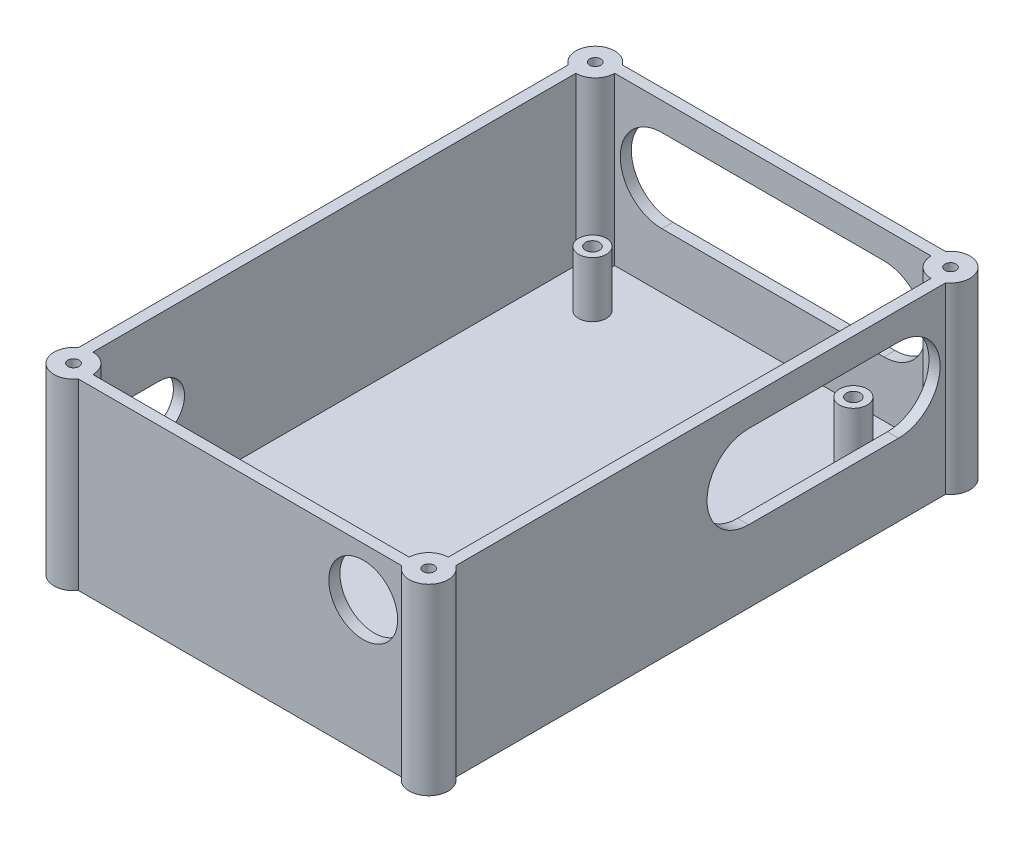
from build123d import *

# Parameters (mm, degrees)
SKETCH1_R             = 2.5
SKETCH1_R_2           = 1.25
BOSS_EXTRUDE1_DEPTH   = 10
BOSS_EXTRUDE1_2_DEPTH = 10
BOSS_EXTRUDE1_3_DEPTH = 10
BOSS_EXTRUDE1_4_DEPTH = 10
SKETCH2_W             = 68
SKETCH2_H             = 98
BOSS_EXTRUDE2_DEPTH   = 3
SKETCH3_W             = 68
SKETCH3_H             = 98
SKETCH3_W_2           = 64
SKETCH3_H_2           = 94
BOSS_EXTRUDE3_DEPTH   = 30
SKETCH4_R             = 6.2
CUT_EXTRUDE1_DEPTH    = 25
CUT_EXTRUDE2_DEPTH    = 5
SKETCH7_R             = 3.5
BOSS_EXTRUDE5_DEPTH   = 33
SKETCH8_R             = 1
CUT_EXTRUDE3_DEPTH    = 7
CUT_EXTRUDE6_DEPTH    = 3.3
CUT_EXTRUDE7_DEPTH    = 10


with BuildPart() as part:
    # Sketch1 → Boss-Extrude1 (new body)
    with BuildSketch(Plane(origin=(0, 0, 0), x_dir=(1, 0, 0), z_dir=(0, 1, 0))):
        with Locations(Location((24.328009845, -38, 0), (0, 0, 270))):
            Circle(SKETCH1_R)
        with Locations(Location((24.328009845, -38, 0), (0, 0, 270))):
            Circle(SKETCH1_R_2, mode=Mode.SUBTRACT)
    extrude(amount=BOSS_EXTRUDE1_DEPTH)



with BuildPart() as body_2:
    # Sketch1 → Boss-Extrude1 2 (new body)
    with BuildSketch(Plane(origin=(0, 0, 0), x_dir=(1, 0, 0), z_dir=(0, 1, 0))):
        with Locations(Location((24.328009845, 38, 0), (0, 0, 270))):
            Circle(SKETCH1_R)
        with Locations(Location((24.328009845, 38, 0), (0, 0, 270))):
            Circle(SKETCH1_R_2, mode=Mode.SUBTRACT)
    extrude(amount=BOSS_EXTRUDE1_2_DEPTH)


with BuildPart() as body_3:
    # Sketch1 → Boss-Extrude1 3 (new body)
    with BuildSketch(Plane(origin=(0, 0, 0), x_dir=(1, 0, 0), z_dir=(0, 1, 0))):
        with Locations(Location((-22.671990155, 38, 0), (0, 0, 270))):
            Circle(SKETCH1_R)
        with Locations(Location((-22.671990155, 38, 0), (0, 0, 270))):
            Circle(SKETCH1_R_2, mode=Mode.SUBTRACT)
    extrude(amount=BOSS_EXTRUDE1_3_DEPTH)


with BuildPart() as body_4:
    # Sketch1 → Boss-Extrude1 4 (new body)
    with BuildSketch(Plane(origin=(0, 0, 0), x_dir=(1, 0, 0), z_dir=(0, 1, 0))):
        with Locations(Location((-22.671990155, -38, 0), (0, 0, 270))):
            Circle(SKETCH1_R)
        with Locations(Location((-22.671990155, -38, 0), (0, 0, 270))):
            Circle(SKETCH1_R_2, mode=Mode.SUBTRACT)
    extrude(amount=BOSS_EXTRUDE1_4_DEPTH)


with BuildPart() as part_1:
    add(part.part)

    add(body_2.part)  # Boss-Extrude2 merges body 2

    add(body_3.part)  # Boss-Extrude2 merges body 3

    add(body_4.part)  # Boss-Extrude2 merges body 4
    # Sketch2 → Boss-Extrude2 (add)
    with BuildSketch(Plane(origin=(0, 0, 0), x_dir=(1, 0, 0), z_dir=(0, 1, 0))):
        with Locations((0.828009845, 0)):
            Rectangle(SKETCH2_W, SKETCH2_H)
    extrude(amount=-BOSS_EXTRUDE2_DEPTH)

    # Sketch3 → Boss-Extrude3 (add)
    with BuildSketch(Plane(origin=(0, 0, 0), x_dir=(1, 0, 0), z_dir=(0, 1, 0))):
        with Locations((0.828009845, 0)):
            Rectangle(SKETCH3_W, SKETCH3_H)
        with Locations((0.828009845, 0)):
            Rectangle(SKETCH3_W_2, SKETCH3_H_2, mode=Mode.SUBTRACT)
    extrude(amount=BOSS_EXTRUDE3_DEPTH)

    # Sketch4 → Cut-Extrude1 (cut)
    with BuildSketch(Plane.XY.offset(49)):
        with Locations((23.028009845, 21.2)):
            Circle(SKETCH4_R)
    extrude(amount=-CUT_EXTRUDE1_DEPTH, mode=Mode.SUBTRACT)

    # Sketch5 → Cut-Extrude2 (cut)
    with BuildSketch(Plane.ZY.offset(33.171990155)):
        with BuildLine():
            Line((42.5, 19.5), (31.5, 19.5))
            ThreePointArc((31.5, 19.5), (28.318019485, 18.181980515), (27, 15))
            Line((27, 15), (37, 15))
            Line((37, 15), (47, 15))
            ThreePointArc((47, 15), (45.681980515, 18.181980515), (42.5, 19.5))
        make_face()
        with BuildLine():
            Line((37, 15), (27, 15))
            ThreePointArc((27, 15), (28.318019485, 11.818019485), (31.5, 10.5))
            Line((31.5, 10.5), (37, 10.5))
            Line((37, 10.5), (37, 15))
        make_face()
        with BuildLine():
            ThreePointArc((42.5, 10.5), (45.681980515, 11.818019485), (47, 15))
            Line((47, 15), (37, 15))
            Line((37, 15), (37, 10.5))
            Line((37, 10.5), (42.5, 10.5))
        make_face()
    extrude(amount=-CUT_EXTRUDE2_DEPTH, mode=Mode.SUBTRACT)

    # Sketch7 → Boss-Extrude5 (add)
    with BuildSketch(Plane(origin=(0, 30, 0), x_dir=(1, 0, 0), z_dir=(0, 1, 0))):
        with Locations((32.828009845, -47)):
            Circle(SKETCH7_R)
        with Locations((32.828009845, 47)):
            Circle(SKETCH7_R)
        with Locations((-31.171990155, 47)):
            Circle(SKETCH7_R)
        with Locations((-31.171990155, -47)):
            Circle(SKETCH7_R)
    extrude(amount=-BOSS_EXTRUDE5_DEPTH)

    # Sketch8 → Cut-Extrude3 (cut)
    with BuildSketch(Plane(origin=(0, 30, 0), x_dir=(1, 0, 0), z_dir=(0, 1, 0))):
        with Locations(Location((-31.171990155, -47, 0), (0, 0, 270))):
            Circle(SKETCH8_R)
        with Locations(Location((32.828009845, -47, 0), (0, 0, 270))):
            Circle(SKETCH8_R)
        with Locations(Location((32.828009845, 47, 0), (0, 0, 270))):
            Circle(SKETCH8_R)
        with Locations(Location((-31.171990155, 47, 0), (0, 0, 270))):
            Circle(SKETCH8_R)
    extrude(amount=-CUT_EXTRUDE3_DEPTH, mode=Mode.SUBTRACT)

    # Sketch12 → Cut-Extrude6 (cut)
    with BuildSketch(Plane(origin=(0, 0, -49), x_dir=(-1, 0, 0), z_dir=(0, 0, -1))):
        with BuildLine():
            Line((-20.828009845, 25), (19.171990155, 25))
            ThreePointArc((19.171990155, 25), (26.671990155, 17.5), (19.171990155, 10))
            Line((19.171990155, 10), (-20.828009845, 10))
            ThreePointArc((-20.828009845, 10), (-28.328009845, 17.5), (-20.828009845, 25))
        make_face()
    extrude(amount=-CUT_EXTRUDE6_DEPTH, mode=Mode.SUBTRACT)

    # Sketch14 → Cut-Extrude7 (cut)
    with BuildSketch(Plane(origin=(34.828009845, 0, 0), x_dir=(0, 0, -1), z_dir=(1, 0, 0))):
        with BuildLine():
            Line((8.633857568, 25), (35.621579786, 25))
            ThreePointArc((35.621579786, 25), (43.121579786, 17.5), (35.621579786, 10))
            Line((35.621579786, 10), (8.633857568, 10))
            ThreePointArc((8.633857568, 10), (1.133857568, 17.5), (8.633857568, 25))
        make_face()
    extrude(amount=-CUT_EXTRUDE7_DEPTH, mode=Mode.SUBTRACT)


solid = part_1.part
